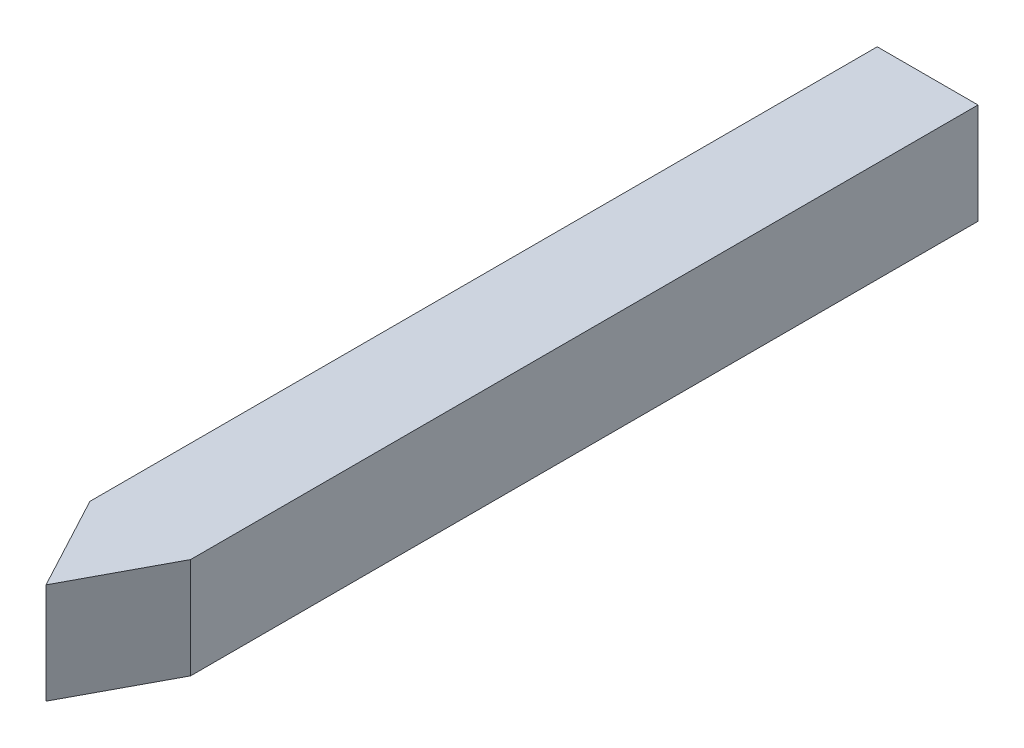
from build123d import *

# Parameters (mm, degrees)
SKETCH1_W           = 12
SKETCH1_H           = 12
BOSS_EXTRUDE1_DEPTH = 105
CUT_EXTRUDE1_DEPTH  = 120


with BuildPart() as part:
    # Sketch1 → Boss-Extrude1 (new body)
    with BuildSketch(Plane.XY):
        Rectangle(SKETCH1_W, SKETCH1_H)
    extrude(amount=BOSS_EXTRUDE1_DEPTH)

    # Sketch2 → Cut-Extrude1 (cut)
    with BuildSketch(Plane(origin=(0, 6, 0), x_dir=(1, 0, 0), z_dir=(0, 1, 0))):
        Polygon((-6, -105), (0, -105), (-6, -93.774608017), align=None)
        Polygon((6, -93.774608017), (0, -105), (6, -105), align=None)
    extrude(amount=-CUT_EXTRUDE1_DEPTH, mode=Mode.SUBTRACT)


solid = part.part
